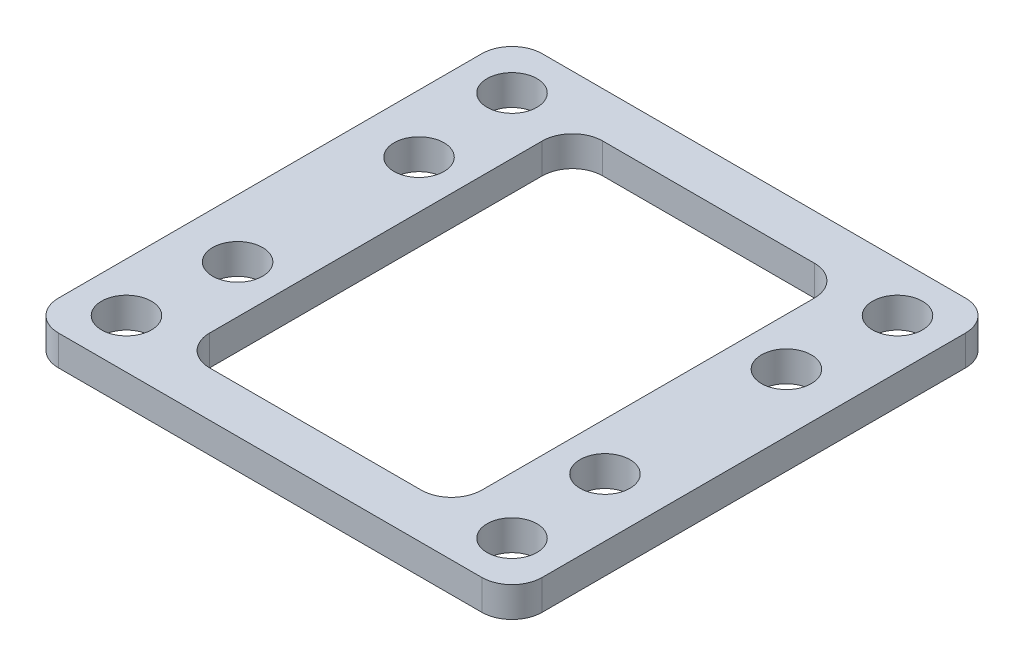
from build123d import *

# Parameters (mm, degrees)
SKETCH_1_W          = 32
SKETCH_1_H          = 32
SKETCH_1_R          = 1.65
EXTRUDE_1_DEPTH     = 2
SKETCH_2_W          = 18
SKETCH_2_H          = 26
CUT_EXTRUDE_1_DEPTH = 23.715633383
FILLET_1_R          = 2


with BuildPart() as part:
    # 草图1 → 凸台-拉伸1 (new body)
    with BuildSketch(Plane(origin=(0, 0, 0), x_dir=(1, 0, 0), z_dir=(0, 1, 0))):
        Rectangle(SKETCH_1_W, SKETCH_1_H)
        with Locations(Location((-12.75, 12.75, 0), (0, 0, 270))):
            Circle(SKETCH_1_R, mode=Mode.SUBTRACT)
        with Locations(Location((12.75, 12.75, 0), (0, 0, 90))):
            Circle(SKETCH_1_R, mode=Mode.SUBTRACT)
        with Locations(Location((12.75, -12.75, 0), (0, 0, 270))):
            Circle(SKETCH_1_R, mode=Mode.SUBTRACT)
        with Locations(Location((-12.75, -12.75, 0), (0, 0, 90))):
            Circle(SKETCH_1_R, mode=Mode.SUBTRACT)
        with Locations(Location((-12.15, 6, 0), (0, 0, 270))):
            Circle(SKETCH_1_R, mode=Mode.SUBTRACT)
        with Locations(Location((-12.15, -6, 0), (0, 0, 90))):
            Circle(SKETCH_1_R, mode=Mode.SUBTRACT)
        with Locations(Location((12.15, -6, 0), (0, 0, 270))):
            Circle(SKETCH_1_R, mode=Mode.SUBTRACT)
        with Locations(Location((12.15, 6, 0), (0, 0, 90))):
            Circle(SKETCH_1_R, mode=Mode.SUBTRACT)
    extrude(amount=EXTRUDE_1_DEPTH)

    # 草图2 → 切除-拉伸1 (cut, through all)
    with BuildSketch(Plane(origin=(0, 2, 0), x_dir=(1, 0, 0), z_dir=(0, 1, 0))):
        Rectangle(SKETCH_2_W, SKETCH_2_H)
    extrude(amount=-CUT_EXTRUDE_1_DEPTH, mode=Mode.SUBTRACT)

    # 圆角1
    fillet_1_edges = [part.edges().sort_by_distance(p)[0] for p in [
        (-9, 1, 13),
        (-9, 1, -13),
        (9, 1, -13),
        (9, 1, 13),
        (16, 1, 16),
        (-16, 1, 16),
        (-16, 1, -16),
        (16, 1, -16),
    ]]
    fillet(fillet_1_edges, radius=FILLET_1_R)


solid = part.part
